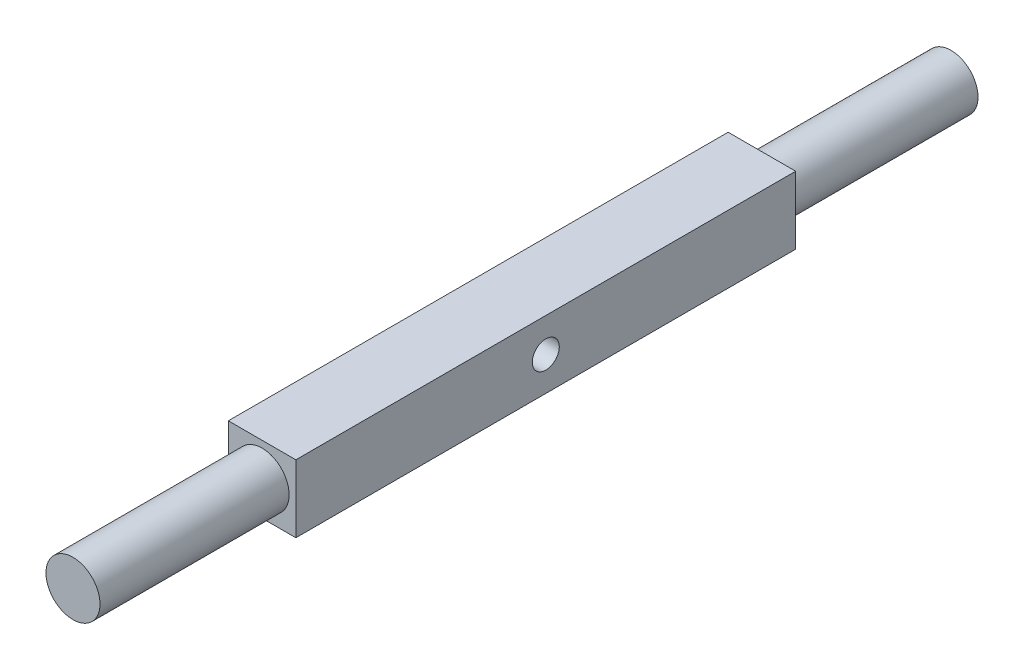
from build123d import *

# Parameters (mm, degrees)
BOSS_EXTRUDE1_DEPTH      = 92.5
BOSS_EXTRUDE1_DEPTH_BACK = 92.5
SKETCH1_W                = 25
SKETCH1_H                = 25
SKETCH2_R                = 5
CUT_EXTRUDE1_DEPTH       = 100.026511602
SKETCH3_R                = 10
BOSS_EXTRUDE2_DEPTH      = 70
BOSS_EXTRUDE3_START      = 70
BOSS_EXTRUDE3_DEPTH      = 70


with BuildPart() as part:
    # Sketch1 → Boss-Extrude1 (new, two sides: drawn at the far end of the back side and taken through both)
    with BuildSketch(Plane.XY.offset(-BOSS_EXTRUDE1_DEPTH_BACK)):
        with Locations((12.5, 12.5)):
            Rectangle(SKETCH1_W, SKETCH1_H)
    extrude(amount=BOSS_EXTRUDE1_DEPTH + BOSS_EXTRUDE1_DEPTH_BACK)

    # Sketch2 → Cut-Extrude1 (cut, through all)
    with BuildSketch(Plane(origin=(25, 0, 0), x_dir=(0, 0, -1), z_dir=(1, 0, 0))):
        with Locations((0, 12.5)):
            Circle(SKETCH2_R)
    extrude(amount=-CUT_EXTRUDE1_DEPTH, mode=Mode.SUBTRACT)

    # Sketch3 → Boss-Extrude2 (add)
    with BuildSketch(Plane.XY.offset(92.5)):
        with Locations((12.5, 12.5)):
            Circle(SKETCH3_R)
    extrude(amount=BOSS_EXTRUDE2_DEPTH)

    # Sketch4 → Boss-Extrude3 (add)
    with BuildSketch(Plane(origin=(0, 0, -92.5), x_dir=(-1, 0, 0), z_dir=(0, 0, -1)).offset(BOSS_EXTRUDE3_START)):
        with BuildLine():
            ThreePointArc((-22.5, 12.5), (-12.5, 2.5), (-2.5, 12.5))
            ThreePointArc((-2.5, 12.5), (-12.5, 22.5), (-22.5, 12.5))
        make_face()
    extrude(amount=-BOSS_EXTRUDE3_DEPTH)


solid = part.part
